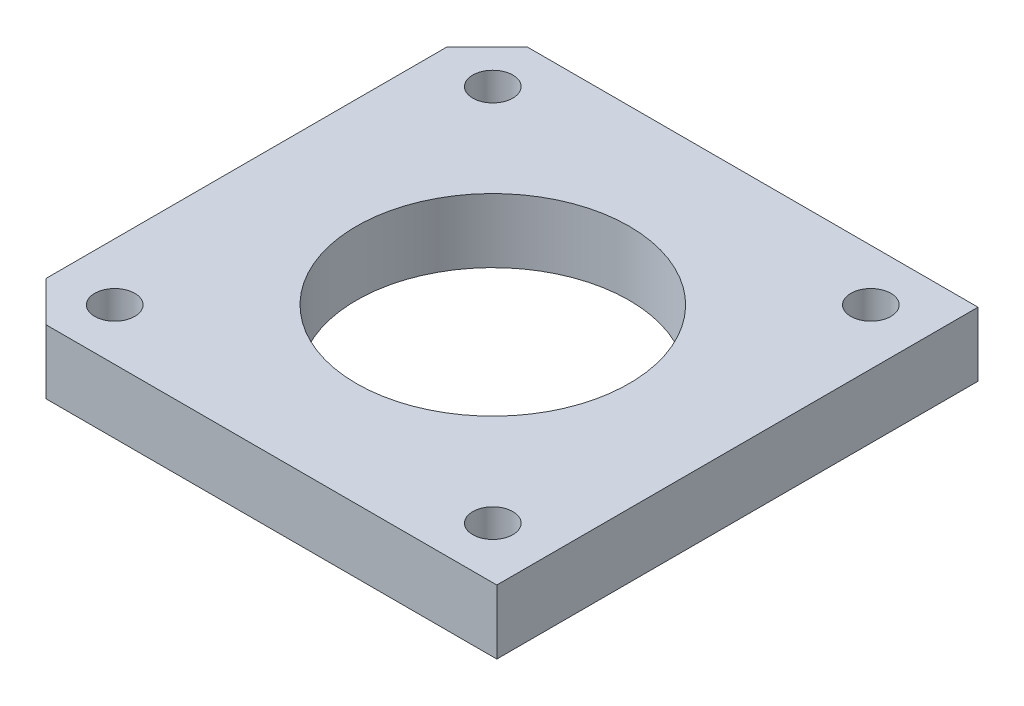
from build123d import *

# Parameters (mm, degrees)
SKETCH2_W          = 61.210230612
SKETCH2_H          = 60
EXTRUDE1_DEPTH     = 8
CHAMFER1_SIZE      = 5
SKETCH3_R          = 17
SKETCH3_R_2        = 2.5
CUT_EXTRUDE1_DEPTH = 53.63316445


with BuildPart() as part:
    # Sketch2 → Extrude1 (new body)
    with BuildSketch(Plane(origin=(0, 0, 0), x_dir=(1, 0, 0), z_dir=(0, 1, 0))):
        with Locations((11.894884694, 0)):
            Rectangle(SKETCH2_W, SKETCH2_H)
    extrude(amount=EXTRUDE1_DEPTH)

    # Chamfer1
    chamfer1_edges = [part.edges().sort_by_distance(p)[0] for p in [
        (-18.710230612, 4, 30),
        (-18.710230612, 4, -30),
    ]]
    chamfer(chamfer1_edges, length=CHAMFER1_SIZE)

    # Sketch3 → Cut-Extrude1 (cut, through all)
    with BuildSketch(Plane(origin=(0, 8, 0), x_dir=(1, 0, 0), z_dir=(0, 1, 0))):
        with Locations(Location((12, 0, 0), (0, 0, 270))):
            Circle(SKETCH3_R)
        with Locations(Location((-11.57, 23.57, 0), (0, 0, 270))):
            Circle(SKETCH3_R_2)
        with Locations(Location((35.57, 23.57, 0), (0, 0, 270))):
            Circle(SKETCH3_R_2)
        with Locations(Location((-11.57, -23.57, 0), (0, 0, 270))):
            Circle(SKETCH3_R_2)
        with Locations(Location((35.57, -23.57, 0), (0, 0, 270))):
            Circle(SKETCH3_R_2)
    extrude(amount=-CUT_EXTRUDE1_DEPTH, mode=Mode.SUBTRACT)


solid = part.part
